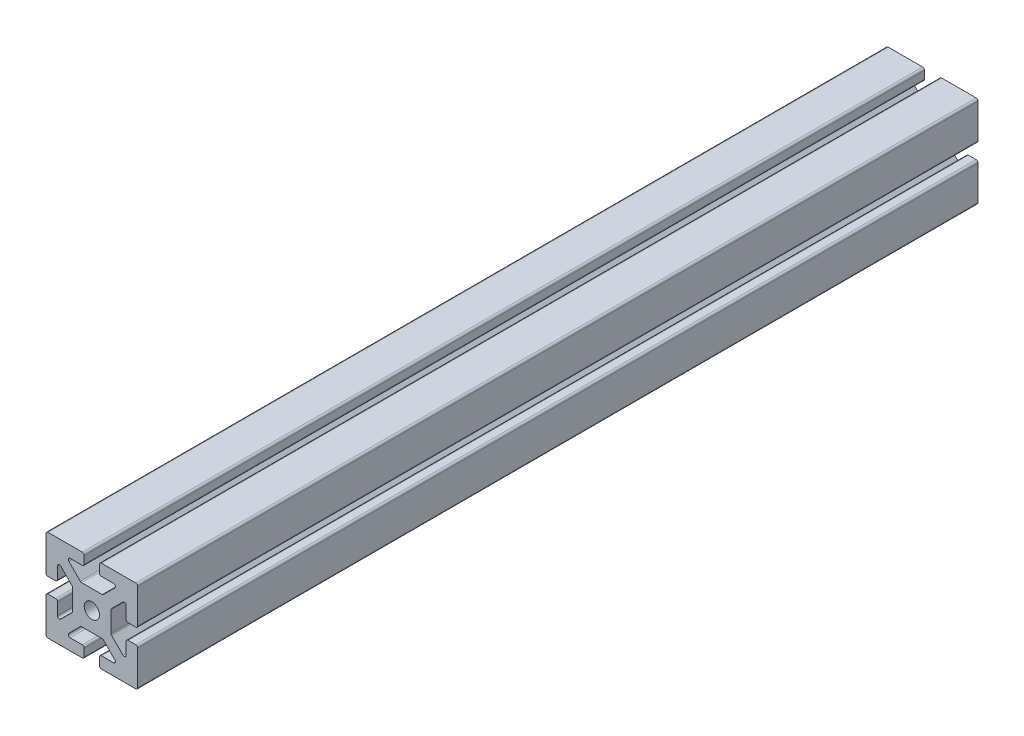
from build123d import *

# Parameters (mm, degrees)
SKETCH2_R           = 1
BOSS_EXTRUDE1_DEPTH = 110


with BuildPart() as part:
    # Sketch2 → Boss-Extrude1 (new body)
    with BuildSketch(Plane.XY):
        with BuildLine():
            Line((0, 2.5), (1.335786438, 2.5))
            ThreePointArc((1.335786438, 2.5), (1.431457296, 2.519030117), (1.512563133, 2.573223305))
            Line((1.512563133, 2.573223305), (3.012563133, 4.073223305))
            ThreePointArc((3.012563133, 4.073223305), (3.066756321, 4.345670858), (2.835786438, 4.5))
            Line((2.835786438, 4.5), (1.25, 4.5))
            ThreePointArc((1.25, 4.5), (1.073223305, 4.573223305), (1, 4.75))
            Line((1, 4.75), (1, 5.75))
            ThreePointArc((1, 5.75), (1.073223305, 5.926776695), (1.25, 6))
            Line((1.25, 6), (5.75, 6))
            ThreePointArc((5.75, 6), (5.926776695, 5.926776695), (6, 5.75))
            Line((6, 5.75), (6, 1.25))
            ThreePointArc((6, 1.25), (5.926776695, 1.073223305), (5.75, 1))
            Line((5.75, 1), (4.748585621, 1))
            ThreePointArc((4.748585621, 1), (4.571808926, 1.073223305), (4.498585621, 1.25))
            Line((4.498585621, 1.25), (4.498585621, 2.834372059))
            ThreePointArc((4.498585621, 2.834372059), (4.344256479, 3.065341942), (4.071808926, 3.011148754))
            Line((4.071808926, 3.011148754), (2.573223305, 1.512563133))
            ThreePointArc((2.573223305, 1.512563133), (2.519030117, 1.431457296), (2.5, 1.335786438))
            Line((2.5, 1.335786438), (2.5, -1.335786438))
            ThreePointArc((2.5, -1.335786438), (2.519030117, -1.431457296), (2.573223305, -1.512563133))
            Line((2.573223305, -1.512563133), (4.071808926, -3.011148754))
            ThreePointArc((4.071808926, -3.011148754), (4.344256479, -3.065341942), (4.498585621, -2.834372059))
            Line((4.498585621, -2.834372059), (4.498585621, -1.25))
            ThreePointArc((4.498585621, -1.25), (4.571808926, -1.073223305), (4.748585621, -1))
            Line((4.748585621, -1), (5.75, -1))
            ThreePointArc((5.75, -1), (5.926776695, -1.073223305), (6, -1.25))
            Line((6, -1.25), (6, -5.75))
            ThreePointArc((6, -5.75), (5.926776695, -5.926776695), (5.75, -6))
            Line((5.75, -6), (1.25, -6))
            ThreePointArc((1.25, -6), (1.073223305, -5.926776695), (1, -5.75))
            Line((1, -5.75), (1, -4.75))
            ThreePointArc((1, -4.75), (1.073223305, -4.573223305), (1.25, -4.5))
            Line((1.25, -4.5), (2.835786438, -4.5))
            ThreePointArc((2.835786438, -4.5), (3.066756321, -4.345670858), (3.012563133, -4.073223305))
            Line((3.012563133, -4.073223305), (1.512563133, -2.573223305))
            ThreePointArc((1.512563133, -2.573223305), (1.431457296, -2.519030117), (1.335786438, -2.5))
            Line((1.335786438, -2.5), (-1.335786438, -2.5))
            ThreePointArc((-1.335786438, -2.5), (-1.431457296, -2.519030117), (-1.512563133, -2.573223305))
            Line((-1.512563133, -2.573223305), (-3.012563133, -4.073223305))
            ThreePointArc((-3.012563133, -4.073223305), (-3.066756321, -4.345670858), (-2.835786438, -4.5))
            Line((-2.835786438, -4.5), (-1.25, -4.5))
            ThreePointArc((-1.25, -4.5), (-1.073223305, -4.573223305), (-1, -4.75))
            Line((-1, -4.75), (-1, -5.75))
            ThreePointArc((-1, -5.75), (-1.073223305, -5.926776695), (-1.25, -6))
            Line((-1.25, -6), (-5.75, -6))
            ThreePointArc((-5.75, -6), (-5.926776695, -5.926776695), (-6, -5.75))
            Line((-6, -5.75), (-6, -1.25))
            ThreePointArc((-6, -1.25), (-5.926776695, -1.073223305), (-5.75, -1))
            Line((-5.75, -1), (-4.748585621, -1))
            ThreePointArc((-4.748585621, -1), (-4.571808926, -1.073223305), (-4.498585621, -1.25))
            Line((-4.498585621, -1.25), (-4.498585621, -2.834372059))
            ThreePointArc((-4.498585621, -2.834372059), (-4.344256479, -3.065341942), (-4.071808926, -3.011148754))
            Line((-4.071808926, -3.011148754), (-2.573223305, -1.512563133))
            ThreePointArc((-2.573223305, -1.512563133), (-2.519030117, -1.431457296), (-2.5, -1.335786438))
            Line((-2.5, -1.335786438), (-2.5, 1.335786438))
            ThreePointArc((-2.5, 1.335786438), (-2.519030117, 1.431457296), (-2.573223305, 1.512563133))
            Line((-2.573223305, 1.512563133), (-4.071808926, 3.011148754))
            ThreePointArc((-4.071808926, 3.011148754), (-4.344256479, 3.065341942), (-4.498585621, 2.834372059))
            Line((-4.498585621, 2.834372059), (-4.498585621, 1.25))
            ThreePointArc((-4.498585621, 1.25), (-4.571808926, 1.073223305), (-4.748585621, 1))
            Line((-4.748585621, 1), (-5.75, 1))
            ThreePointArc((-5.75, 1), (-5.926776695, 1.073223305), (-6, 1.25))
            Line((-6, 1.25), (-6, 5.75))
            ThreePointArc((-6, 5.75), (-5.926776695, 5.926776695), (-5.75, 6))
            Line((-5.75, 6), (-1.25, 6))
            ThreePointArc((-1.25, 6), (-1.073223305, 5.926776695), (-1, 5.75))
            Line((-1, 5.75), (-1, 4.75))
            ThreePointArc((-1, 4.75), (-1.073223305, 4.573223305), (-1.25, 4.5))
            Line((-1.25, 4.5), (-2.835786438, 4.5))
            ThreePointArc((-2.835786438, 4.5), (-3.066756321, 4.345670858), (-3.012563133, 4.073223305))
            Line((-3.012563133, 4.073223305), (-1.512563133, 2.573223305))
            ThreePointArc((-1.512563133, 2.573223305), (-1.431457296, 2.519030117), (-1.335786438, 2.5))
            Line((-1.335786438, 2.5), (0, 2.5))
        make_face()
        Circle(SKETCH2_R, mode=Mode.SUBTRACT)
    extrude(amount=-BOSS_EXTRUDE1_DEPTH)


solid = part.part
